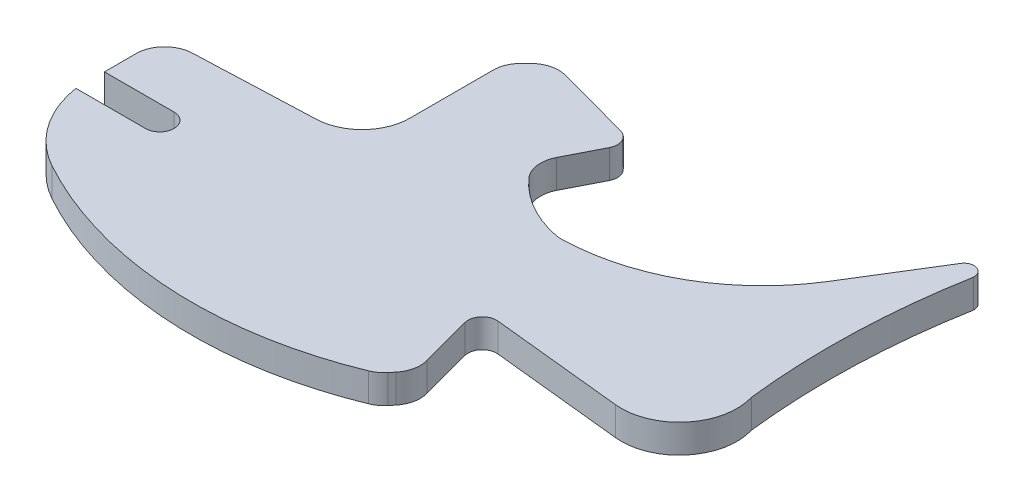
from build123d import *

# Parameters (mm, degrees)
BOSS_EXTRUDE1_DEPTH = 3
FILLET1_R           = 1.5
FILLET2_R           = 3
FILLET3_R           = 1.5
FILLET4_R           = 5


with BuildPart() as part:
    # Sketch1 → Boss-Extrude1 (new body)
    with BuildSketch(Plane(origin=(0, 0, 0), x_dir=(1, 0, 0), z_dir=(0, 1, 0))):
        with BuildLine():
            Line((0, 0), (7.31, 0))
            ThreePointArc((7.31, 0), (8.81, -1.5), (7.31, -3))
            Line((7.31, -3), (0, -3))
            ThreePointArc((0, -3), (1.941416089, -7.839258354), (5.823510613, -11.320186386))
            ThreePointArc((5.823510613, -11.320186386), (23.597809929, -16.33), (41.768131919, -13.034040752))
            ThreePointArc((41.768131919, -13.034040752), (42.687342923, -11.923770269), (43.59, -10.8))
            Line((43.59, -10.8), (41.17, -1.78))
            Line((41.17, -1.78), (57.126632367, -3.44))
            ThreePointArc((57.126632367, -3.44), (62.451393238, -1.255638394), (63.57, 4.39))
            ThreePointArc((63.57, 4.39), (63.114921372, 15.71270599), (64.31568295, 26.980755472))
            ThreePointArc((64.31568295, 26.980755472), (63.57, 28), (62.39039615, 27.548959839))
            Line((62.39039615, 27.548959839), (57.126632367, 19.028512497))
            ThreePointArc((57.126632367, 19.028512497), (49.331544712, 11.549647985), (38.89, 8.78))
            ThreePointArc((38.89, 8.78), (34.195061115, 10.662812141), (30.69, 14.31))
            Line((30.69, 14.31), (34.24, 21.27))
            Line((34.24, 21.27), (22.85, 24.35))
            Line((22.85, 24.35), (20.25, 21.818890812))
            Line((20.25, 21.818890812), (20.25, 7.003260248))
            Line((20.25, 7.003260248), (0, 6.204789211))
            Line((0, 6.204789211), (0, 0))
        make_face()
    extrude(amount=BOSS_EXTRUDE1_DEPTH)

    # Fillet1
    fillet1_edges = [part.edges().sort_by_distance(p)[0] for p in [
        (41.17, 1.5, 1.78),
    ]]
    fillet(fillet1_edges, radius=FILLET1_R)

    # Fillet2
    fillet2_edges = [part.edges().sort_by_distance(p)[0] for p in [
        (22.85, 1.5, -24.35),
        (30.69, 1.5, -14.31),
        (38.89, 1.5, -8.78),
        (43.59, 1.5, 10.8),
        (41.768131919, 1.5, 13.034040752),
        (0, 1.5, -6.204789211),
        (20.25, 1.5, -21.818890812),
    ]]
    fillet(fillet2_edges, radius=FILLET2_R)

    # Fillet3
    fillet3_edges = [part.edges().sort_by_distance(p)[0] for p in [
        (34.24, 1.5, -21.27),
    ]]
    fillet(fillet3_edges, radius=FILLET3_R)

    # Fillet4
    fillet4_edges = [part.edges().sort_by_distance(p)[0] for p in [
        (20.25, 1.5, -7.003260248),
    ]]
    fillet(fillet4_edges, radius=FILLET4_R)


solid = part.part
